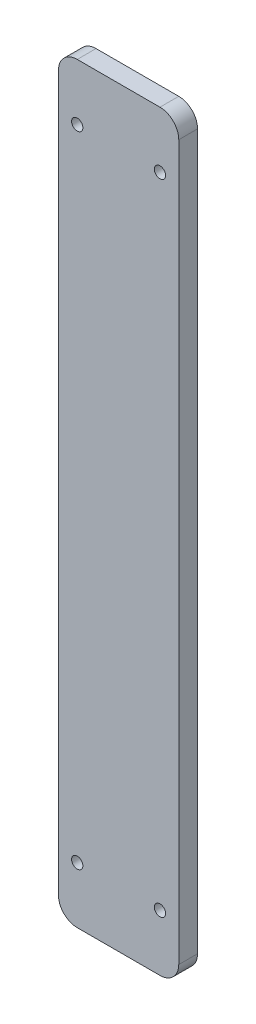
from build123d import *

# Parameters (mm, degrees)
ESQUISSE1_W             = 32
ESQUISSE1_H             = 200
BOSS_EXTRU_1_DEPTH      = 5
CONG_1_R                = 5
ESQUISSE2_R             = 1.5
ENL_V_MAT_EXTRU_1_DEPTH = 10


with BuildPart() as part:
    # Esquisse1 → Boss.-Extru.1 (new body)
    with BuildSketch(Plane.XY):
        Rectangle(ESQUISSE1_W, ESQUISSE1_H)
    extrude(amount=BOSS_EXTRU_1_DEPTH)

    # Congé1
    cong_1_edges = [part.edges().sort_by_distance(p)[0] for p in [
        (16, -100, 2.5),
        (-16, -100, 2.5),
        (-16, 100, 2.5),
        (16, 100, 2.5),
    ]]
    fillet(cong_1_edges, radius=CONG_1_R)

    # Esquisse2 → Enlèv. mat.-Extru.1 (cut)
    with BuildSketch(Plane.XY.offset(5)):
        with Locations((-11, -85)):
            Circle(ESQUISSE2_R)
        with Locations((11, -85)):
            Circle(ESQUISSE2_R)
        with Locations((11, 85)):
            Circle(ESQUISSE2_R)
        with Locations((-11, 85)):
            Circle(ESQUISSE2_R)
    extrude(amount=-ENL_V_MAT_EXTRU_1_DEPTH, mode=Mode.SUBTRACT)


solid = part.part
